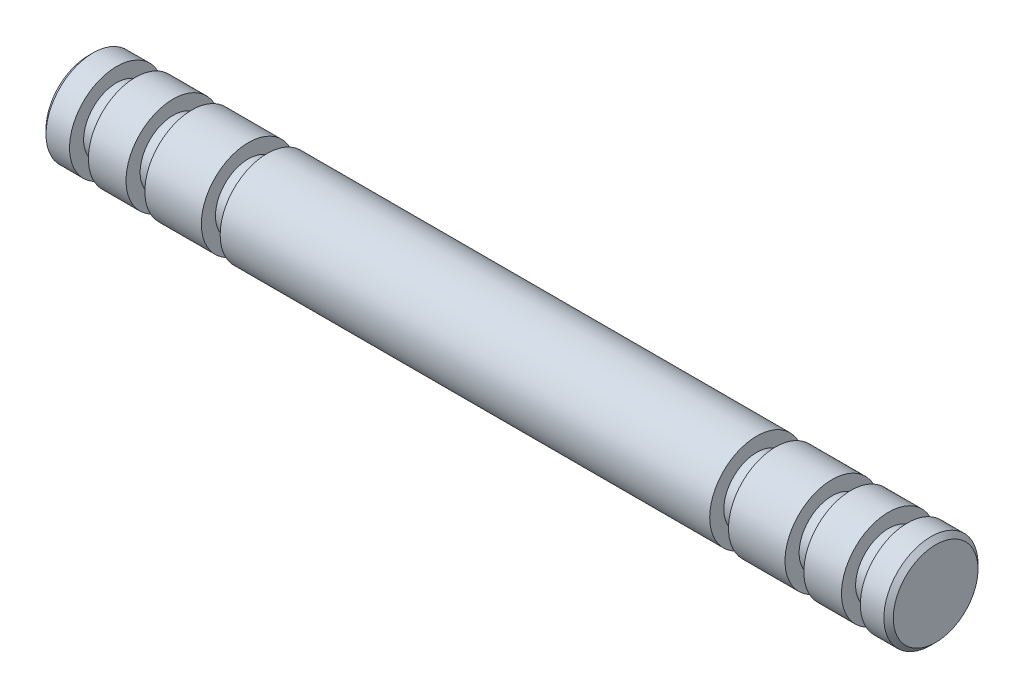
from build123d import *

# Parameters (mm, degrees)
SKETCH_1_R          = 5
EXTRUDE_1_DEPTH     = 52
SKETCH_2_R          = 3.5
EXTRUDE_2_DEPTH     = 2
SKETCH_3_R          = 5
EXTRUDE_3_DEPTH     = 14
SKETCH_4_R          = 5
EXTRUDE_4_DEPTH     = 2
SKETCH_5_R          = 5
EXTRUDE_5_DEPTH     = 4
SKETCH_6_R          = 5
EXTRUDE_6_DEPTH     = 2
SKETCH_7_R          = 5
EXTRUDE_7_DEPTH     = 10
EXTRUDE_START       = 2
SKETCH_8_R          = 3.5
EXTRUDE_8_DEPTH     = 2
EXTRUDE_START_2     = 14
SKETCH_9_R          = 5
EXTRUDE_9_DEPTH     = 14
SKETCH_10_R         = 5
EXTRUDE_10_DEPTH    = 2
EXTRUDE_START_3     = 4
SKETCH_11_R         = 5
EXTRUDE_11_DEPTH    = 4
SKETCH_12_R         = 5
EXTRUDE_12_DEPTH    = 2
EXTRUDE_START_4     = 10
SKETCH_13_R         = 5
EXTRUDE_13_DEPTH    = 10
CHAMFER_1_SIZE      = 0.5
CUT_EXTRUDE_START   = -2
SKETCH_14_R         = 5
SKETCH_14_R_2       = 3.5
CUT_EXTRUDE_1_DEPTH = 2
SKETCH_15_R         = 5
SKETCH_15_R_2       = 3.5
CUT_EXTRUDE_2_DEPTH = 2
CUT_EXTRUDE_START_2 = -15
SKETCH_16_R         = 5
CUT_EXTRUDE_3_DEPTH = 15
SKETCH_17_R         = 5
CUT_EXTRUDE_4_DEPTH = 15
CHAMFER_2_SIZE      = 0.5


with BuildPart() as part:
    # 草图1 → 凸台-拉伸1 (new body)
    with BuildSketch(Plane(origin=(0, 0, 0), x_dir=(0, 0, -1), z_dir=(1, 0, 0))):
        with Locations(Location((0, 0, 0), (0, 0, 180))):
            Circle(SKETCH_1_R)
    extrude(amount=EXTRUDE_1_DEPTH)

    # 草图2 → 凸台-拉伸2 (add)
    with BuildSketch(Plane(origin=(52, 0, 0), x_dir=(0, 0, -1), z_dir=(1, 0, 0))):
        Circle(SKETCH_2_R)
    extrude(amount=EXTRUDE_2_DEPTH)

    # 草图3 → 凸台-拉伸3 (add)
    with BuildSketch(Plane(origin=(54, 0, 0), x_dir=(0, 0, -1), z_dir=(1, 0, 0))):
        with Locations(Location((0, 0, 0), (0, 0, 180))):
            Circle(SKETCH_3_R)
    extrude(amount=EXTRUDE_3_DEPTH)

    # 草图4 → 凸台-拉伸4 (add)
    with BuildSketch(Plane(origin=(68, 0, 0), x_dir=(0, 0, -1), z_dir=(1, 0, 0))):
        with Locations(Location((0, 0, 0), (0, 0, 180))):
            Circle(SKETCH_4_R)
    extrude(amount=EXTRUDE_4_DEPTH)

    # 草图5 → 凸台-拉伸5 (add)
    with BuildSketch(Plane(origin=(70, 0, 0), x_dir=(0, 0, -1), z_dir=(1, 0, 0))):
        with Locations(Location((0, 0, 0), (0, 0, 180))):
            Circle(SKETCH_5_R)
    extrude(amount=EXTRUDE_5_DEPTH)

    # 草图6 → 凸台-拉伸6 (add)
    with BuildSketch(Plane(origin=(74, 0, 0), x_dir=(0, 0, -1), z_dir=(1, 0, 0))):
        with Locations(Location((0, 0, 0), (0, 0, 180))):
            Circle(SKETCH_6_R)
    extrude(amount=EXTRUDE_6_DEPTH)

    # 草图7 → 凸台-拉伸7 (add)
    with BuildSketch(Plane(origin=(76, 0, 0), x_dir=(0, 0, -1), z_dir=(1, 0, 0))):
        with Locations(Location((0, 0, 0), (0, 0, 180))):
            Circle(SKETCH_7_R)
    extrude(amount=EXTRUDE_7_DEPTH)

    # 草图8 → 凸台-拉伸8 (add)
    with BuildSketch(Plane.ZY.offset(EXTRUDE_START)):
        with Locations(Location((0, 0, 0), (0, 0, 180))):
            Circle(SKETCH_8_R)
    extrude(amount=-EXTRUDE_8_DEPTH)

    # 草图9 → 凸台-拉伸9 (add)
    with BuildSketch(Plane.ZY.offset(2).offset(EXTRUDE_START_2)):
        Circle(SKETCH_9_R)
    extrude(amount=-EXTRUDE_9_DEPTH)

    # 草图10 → 凸台-拉伸10 (add)
    with BuildSketch(Plane.ZY.offset(16).offset(EXTRUDE_START)):
        Circle(SKETCH_10_R)
    extrude(amount=-EXTRUDE_10_DEPTH)

    # 草图11 → 凸台-拉伸11 (add)
    with BuildSketch(Plane.ZY.offset(18).offset(EXTRUDE_START_3)):
        Circle(SKETCH_11_R)
    extrude(amount=-EXTRUDE_11_DEPTH)

    # 草图12 → 凸台-拉伸12 (add)
    with BuildSketch(Plane.ZY.offset(22).offset(EXTRUDE_START)):
        Circle(SKETCH_12_R)
    extrude(amount=-EXTRUDE_12_DEPTH)

    # 草图13 → 凸台-拉伸13 (add)
    with BuildSketch(Plane.ZY.offset(24).offset(EXTRUDE_START_4)):
        Circle(SKETCH_13_R)
    extrude(amount=-EXTRUDE_13_DEPTH)

    # 倒角1
    chamfer_1_edges = [part.edges().sort_by_distance(p)[0] for p in [
        (86, 0, -5),
        (-34, 0, -5),
    ]]
    chamfer(chamfer_1_edges, length=CHAMFER_1_SIZE)

    # 草图14 → 切除-拉伸1 (cut)
    with BuildSketch(Plane(origin=(-8, 0, 0), x_dir=(0, 0, -1), z_dir=(1, 0, 0)).offset(CUT_EXTRUDE_START)):
        with Locations(Location((0, 0, 0), (0, 0, 180))):
            Circle(SKETCH_14_R)
        Circle(SKETCH_14_R_2, mode=Mode.SUBTRACT)
    cut_extrude_1 = extrude(amount=CUT_EXTRUDE_1_DEPTH, mode=Mode.SUBTRACT)

    # 草图15 → 切除-拉伸2 (cut)
    with BuildSketch(Plane(origin=(-14, 0, 0), x_dir=(0, 0, -1), z_dir=(1, 0, 0)).offset(CUT_EXTRUDE_START)):
        with Locations(Location((0, 0, 0), (0, 0, 180))):
            Circle(SKETCH_15_R)
        Circle(SKETCH_15_R_2, mode=Mode.SUBTRACT)
    cut_extrude_2 = extrude(amount=CUT_EXTRUDE_2_DEPTH, mode=Mode.SUBTRACT)

    # 镜向1: 切除-拉伸1, 切除-拉伸2 across plane
    add(cut_extrude_1.mirror(Plane(origin=(26, 0, 0), x_dir=(0, 0, 1), z_dir=(1, 0, 0))), mode=Mode.SUBTRACT)
    add(cut_extrude_2.mirror(Plane(origin=(26, 0, 0), x_dir=(0, 0, 1), z_dir=(1, 0, 0))), mode=Mode.SUBTRACT)

    # 草图16 → 切除-拉伸3 (cut)
    with BuildSketch(Plane(origin=(86, 0, 0), x_dir=(0, 0, -1), z_dir=(1, 0, 0)).offset(CUT_EXTRUDE_START_2)):
        Circle(SKETCH_16_R)
    extrude(amount=CUT_EXTRUDE_3_DEPTH, mode=Mode.SUBTRACT)

    # 草图17 → 切除-拉伸4 (cut)
    with BuildSketch(Plane.ZY.offset(34)):
        with Locations(Location((0, 0, 0), (0, 0, 180))):
            Circle(SKETCH_17_R)
    extrude(amount=-CUT_EXTRUDE_4_DEPTH, mode=Mode.SUBTRACT)

    # 倒角2
    chamfer_2_edges = [part.edges().sort_by_distance(p)[0] for p in [
        (-19, 0, -5),
        (71, 0, -5),
    ]]
    chamfer(chamfer_2_edges, length=CHAMFER_2_SIZE)


solid = part.part
